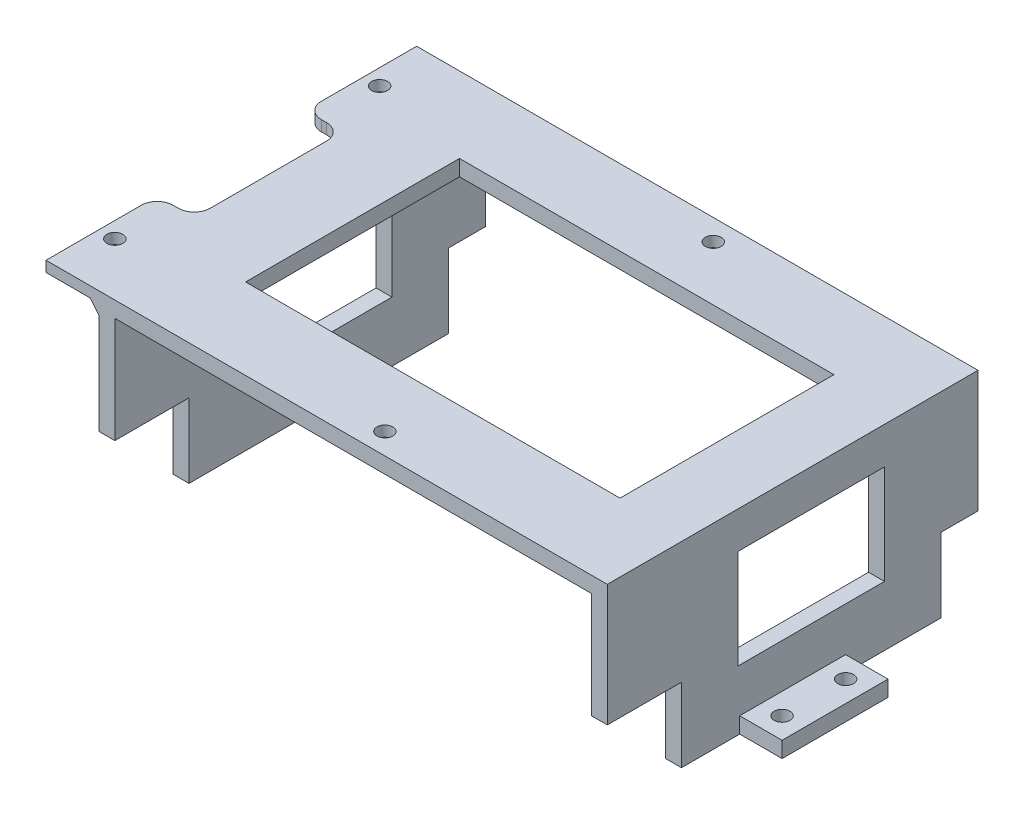
from build123d import *

# Parameters (mm, degrees)
SKETCH_1_W          = 3
SKETCH_1_H          = 70
SKETCH_1_W_2        = 90
EXTRUDE_1_DEPTH     = 3
SKETCH_1_3_W        = 3
SKETCH_1_3_H        = 70
EXTRUDE_2_DEPTH     = 34
SKETCH_2_W          = 20
SKETCH_2_H          = 3
EXTRUDE_3_DEPTH     = 8
SKETCH_3_R          = 1.5
CUT_EXTRUDE_1_DEPTH = 8
SKETCH_5_W          = 70
SKETCH_5_H          = 2
EXTRUDE_4_DEPTH     = 10
SKETCH_4_R          = 1.5
CUT_EXTRUDE_2_DEPTH = 2
SKETCH_6_W          = 7
SKETCH_6_H          = 28
CUT_EXTRUDE_3_DEPTH = 2
FILLET_1_R          = 3
SKETCH_7_W          = 14
SKETCH_7_H          = 14
SKETCH_7_W_2        = 7
CUT_EXTRUDE_4_DEPTH = 3
SKETCH_8_W          = 14
SKETCH_8_H          = 14
SKETCH_8_W_2        = 7
CUT_EXTRUDE_5_DEPTH = 3
SKETCH_9_W          = 70.71367567
SKETCH_9_H          = 40.396420294
CUT_EXTRUDE_6_DEPTH = 3
CUT_EXTRUDE_7_REACH = 116.878
SKETCH_10_W         = 27.669088334
SKETCH_10_H         = 18.732687127
CHAMFER_1_SIZE      = 2
CHAMFER_1_SIZE2     = 1.678199262


with BuildPart() as part:
    # 草图1 → 凸台-拉伸1 (new body)
    with BuildSketch(Plane(origin=(0, 0, 0), x_dir=(1, 0, 0), z_dir=(0, 1, 0))):
        with Locations((-46.5, 0)):
            Rectangle(SKETCH_1_W, SKETCH_1_H)
        Rectangle(SKETCH_1_W_2, SKETCH_1_H)
        with Locations((46.5, 0)):
            Rectangle(SKETCH_1_W, SKETCH_1_H)
    extrude(amount=EXTRUDE_1_DEPTH)

    # 草图1<3> → 凸台-拉伸2 (add)
    with BuildSketch(Plane(origin=(0, 0, 0), x_dir=(1, 0, 0), z_dir=(0, 1, 0))):
        with Locations((-46.5, 0)):
            Rectangle(SKETCH_1_3_W, SKETCH_1_3_H)
        with Locations((46.5, 0)):
            Rectangle(SKETCH_1_3_W, SKETCH_1_3_H)
    extrude(amount=-EXTRUDE_2_DEPTH)

    # 草图2 → 凸台-拉伸3 (add)
    with BuildSketch(Plane.ZY.offset(48)):
        with Locations((0, -32.5)):
            Rectangle(SKETCH_2_W, SKETCH_2_H)
    extrude_3 = extrude(amount=EXTRUDE_3_DEPTH)

    # 镜向1: 凸台-拉伸3 across plane
    add(extrude_3.mirror(Plane(origin=(0, 0, 0), x_dir=(0, 0, 1), z_dir=(1, 0, 0))))

    # 草图3 → 切除-拉伸1 (cut)
    with BuildSketch(Plane(origin=(0, -31, 0), x_dir=(1, 0, 0), z_dir=(0, 1, 0))):
        with Locations(Location((-52, 6, 0), (0, 0, 270))):
            Circle(SKETCH_3_R)
        with Locations(Location((-52, -6, 0), (0, 0, 270))):
            Circle(SKETCH_3_R)
    cut_extrude_1 = extrude(amount=-CUT_EXTRUDE_1_DEPTH, mode=Mode.SUBTRACT)

    # 镜向3: 切除-拉伸1 across plane
    add(cut_extrude_1.mirror(Plane(origin=(0, 0, 0), x_dir=(0, 0, 1), z_dir=(1, 0, 0))), mode=Mode.SUBTRACT)

    # 草图5 → 凸台-拉伸4 (add)
    with BuildSketch(Plane.ZY.offset(48)):
        with Locations((0, 2)):
            Rectangle(SKETCH_5_W, SKETCH_5_H)
    extrude(amount=EXTRUDE_4_DEPTH)

    # 草图4 → 切除-拉伸2 (cut)
    with BuildSketch(Plane(origin=(0, 3, 0), x_dir=(1, 0, 0), z_dir=(0, 1, 0))):
        with Locations(Location((-55, 25, 0), (0, 0, 270))):
            Circle(SKETCH_4_R)
        with Locations(Location((-55, -25, 0), (0, 0, 270))):
            Circle(SKETCH_4_R)
        with Locations(Location((2, 31, 0), (0, 0, 270))):
            Circle(SKETCH_4_R)
        with Locations(Location((2, -31, 0), (0, 0, 270))):
            Circle(SKETCH_4_R)
    extrude(amount=-CUT_EXTRUDE_2_DEPTH, mode=Mode.SUBTRACT)

    # 草图6 → 切除-拉伸3 (cut)
    with BuildSketch(Plane(origin=(0, 3, 0), x_dir=(1, 0, 0), z_dir=(0, 1, 0))):
        with Locations((-54.5, 0)):
            Rectangle(SKETCH_6_W, SKETCH_6_H)
    extrude(amount=-CUT_EXTRUDE_3_DEPTH, mode=Mode.SUBTRACT)

    # 圆角1
    fillet_1_edges = [part.edges().sort_by_distance(p)[0] for p in [
        (-58, 2, 14),
        (-58, 2, -14),
        (-51, 2, -14),
        (-51, 2, 14),
    ]]
    fillet(fillet_1_edges, radius=FILLET_1_R)

    # 草图7 → 切除-拉伸4 (cut)
    with BuildSketch(Plane.ZY.offset(-45)):
        with Locations((28, -27)):
            Rectangle(SKETCH_7_W, SKETCH_7_H)
        with Locations((-31.5, -27)):
            Rectangle(SKETCH_7_W_2, SKETCH_7_H)
    extrude(amount=-CUT_EXTRUDE_4_DEPTH, mode=Mode.SUBTRACT)

    # 草图8 → 切除-拉伸5 (cut)
    with BuildSketch(Plane.ZY.offset(48)):
        with Locations((28, -27)):
            Rectangle(SKETCH_8_W, SKETCH_8_H)
        with Locations((-31.5, -27)):
            Rectangle(SKETCH_8_W_2, SKETCH_8_H)
    extrude(amount=-CUT_EXTRUDE_5_DEPTH, mode=Mode.SUBTRACT)

    # 草图9 → 切除-拉伸6 (cut)
    with BuildSketch(Plane(origin=(0, 3, 0), x_dir=(1, 0, 0), z_dir=(0, 1, 0))):
        with Locations((-0.249939669, 0.491140899)):
            Rectangle(SKETCH_9_W, SKETCH_9_H)
    extrude(amount=-CUT_EXTRUDE_6_DEPTH, mode=Mode.SUBTRACT)

    # 切除-拉伸7: up to this face of the body (flat: up to its plane)
    cut_extrude_7_end = Plane(part.part.faces().sort_by_distance((48, -13.531753131, -1.073792487))[0])
    # 草图10 → 切除-拉伸7 (cut, up to the picked face)
    with BuildSketch(Plane.ZY.offset(48), mode=Mode.PRIVATE) as cut_extrude_7_sk1:
        with Locations((-3.501584346, -13.325871908)):
            Rectangle(SKETCH_10_W, SKETCH_10_H)
    cut_extrude_7_tool1 = split(extrude(cut_extrude_7_sk1.sketch, amount=-CUT_EXTRUDE_7_REACH, mode=Mode.PRIVATE), bisect_by=cut_extrude_7_end, keep=Keep.BOTH, mode=Mode.PRIVATE)
    add(cut_extrude_7_tool1.solids().sort_by(Axis((-48, -13.325872, -3.501584), (1, 0, 0)))[0], mode=Mode.SUBTRACT)

    # 倒角1
    chamfer_1_edges = [part.edges().sort_by_distance(p)[0] for p in [
        (-48, 1, 0),
    ]]
    chamfer_1_side = [part.faces().sort_by_distance(p)[0] for p in [
        (-48, -33.217376208, -19),
    ]]
    chamfer(chamfer_1_edges, length=CHAMFER_1_SIZE, length2=CHAMFER_1_SIZE2, reference=chamfer_1_side[0])


solid = part.part
